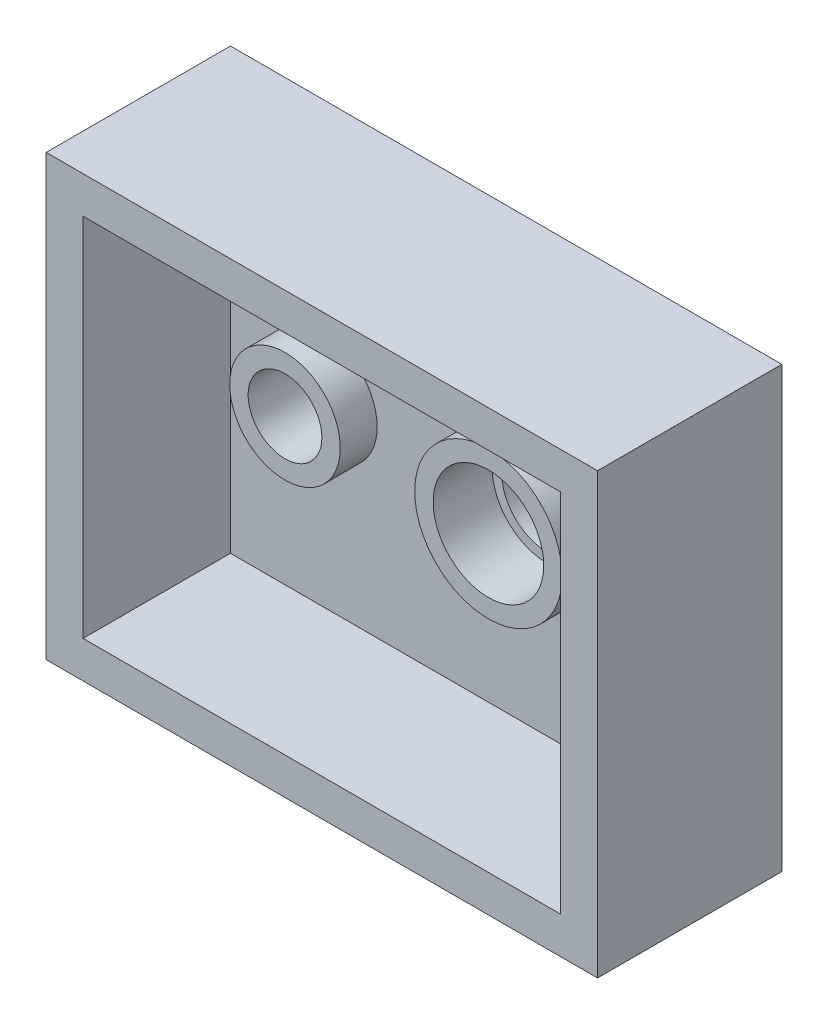
from build123d import *

# Parameters (mm, degrees)
SKETCH2_W           = 47.498
SKETCH2_H           = 37.846
BOSS_EXTRUDE1_DEPTH = 3.175
SKETCH4_W           = 47.498
SKETCH4_H           = 37.846
SKETCH4_W_2         = 41.148
SKETCH4_H_2         = 31.496
BOSS_EXTRUDE2_DEPTH = 12.7
SKETCH5_R           = 4.7625
SKETCH5_R_2         = 6.35
BOSS_EXTRUDE3_DEPTH = 6.35
SKETCH6_R           = 4.7625
SKETCH6_R_2         = 3.175
CUT_EXTRUDE1_DEPTH  = 5.08
SKETCH7_R           = 1.524
SKETCH7_R_2         = 3.937
CUT_EXTRUDE2_DEPTH  = 43.987201933


with BuildPart() as part:
    # Sketch2 → Boss-Extrude1 (new body)
    with BuildSketch(Plane.XY):
        with Locations((12.7, 0)):
            Rectangle(SKETCH2_W, SKETCH2_H)
    extrude(amount=BOSS_EXTRUDE1_DEPTH)

    # Sketch4 → Boss-Extrude2 (add)
    with BuildSketch(Plane.XY.offset(3.175)):
        with Locations((12.7, 0)):
            Rectangle(SKETCH4_W, SKETCH4_H)
        with Locations((12.7, 0)):
            Rectangle(SKETCH4_W_2, SKETCH4_H_2, mode=Mode.SUBTRACT)
    extrude(amount=BOSS_EXTRUDE2_DEPTH)

    # Sketch5 → Boss-Extrude3 (add)
    with BuildSketch(Plane(origin=(0, 0, 0), x_dir=(-1, 0, 0), z_dir=(0, 0, -1))):
        Circle(SKETCH5_R)
        with Locations((-17.526, 0)):
            Circle(SKETCH5_R_2)
    extrude(amount=-BOSS_EXTRUDE3_DEPTH)

    # Sketch6 → Cut-Extrude1 (cut)
    with BuildSketch(Plane.XY.offset(6.35)):
        with Locations((17.526, 0)):
            Circle(SKETCH6_R)
        Circle(SKETCH6_R_2)
    extrude(amount=-CUT_EXTRUDE1_DEPTH, mode=Mode.SUBTRACT)

    # Sketch7 → Cut-Extrude2 (cut, through all)
    with BuildSketch(Plane.XY.offset(3.175)):
        Circle(SKETCH7_R)
        with Locations((17.526, 0)):
            Circle(SKETCH7_R_2)
    extrude(amount=-CUT_EXTRUDE2_DEPTH, mode=Mode.SUBTRACT)


solid = part.part
